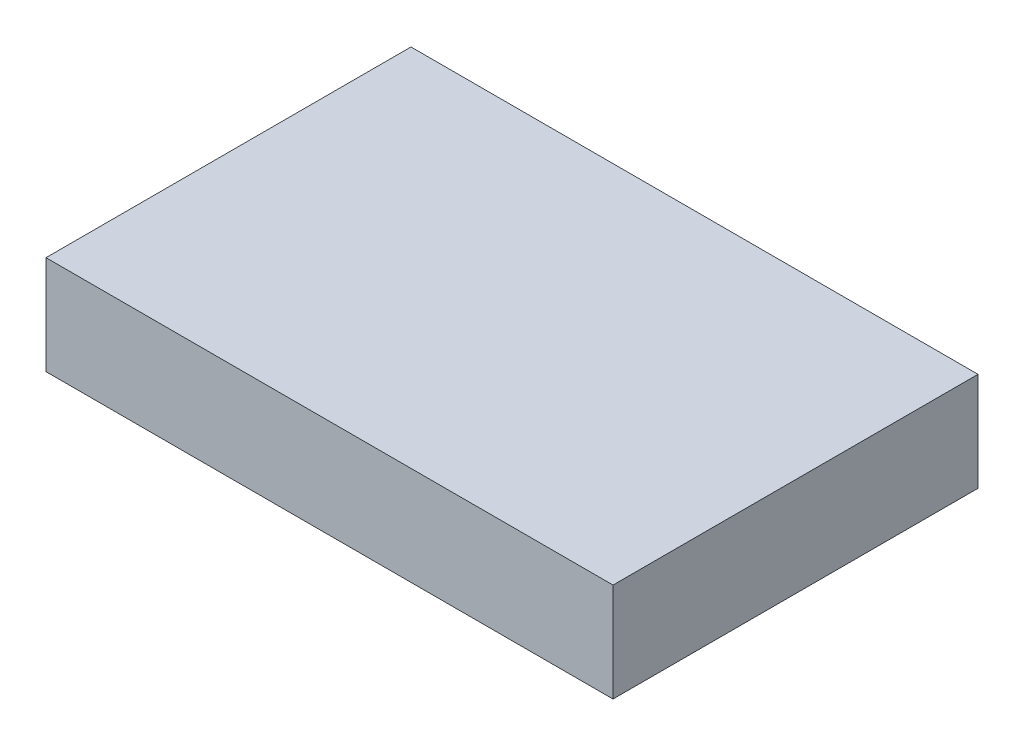
from build123d import *

# Parameters (mm, degrees)
SKETCH_1_W          = 87
SKETCH_1_H          = 56
EXTRUDE_1_DEPTH     = 15.15
SKETCH_2_R          = 1.364499713
SKETCH_2_R_2        = 1.5
CUT_EXTRUDE_1_DEPTH = 10


with BuildPart() as part:
    # Эскиз1 → Бобышка-Вытянуть1 (new body)
    with BuildSketch(Plane(origin=(0, 0, 0), x_dir=(1, 0, 0), z_dir=(0, 1, 0))):
        Rectangle(SKETCH_1_W, SKETCH_1_H)
    extrude(amount=EXTRUDE_1_DEPTH)

    # Эскиз2 → Вырез-Вытянуть1 (cut)
    with BuildSketch(Plane.XZ):
        with Locations(Location((40, 24.5, 0), (0, 0, 270))):
            Circle(SKETCH_2_R)
        with Locations(Location((40.032744033, -18.451055431, 0), (0, 0, 270))):
            Circle(SKETCH_2_R_2)
        with Locations(Location((40, -24.5, 0), (0, 0, 270))):
            Circle(SKETCH_2_R)
        with Locations(Location((-18.085512482, -24.5, 0), (0, 0, 270))):
            Circle(SKETCH_2_R)
        with Locations(Location((-17.736958402, 18.300913925, 0), (0, 0, 270))):
            Circle(SKETCH_2_R_2)
        with Locations(Location((-18.085512482, 24.5, 0), (0, 0, 270))):
            Circle(SKETCH_2_R)
    extrude(amount=-CUT_EXTRUDE_1_DEPTH, mode=Mode.SUBTRACT)


solid = part.part
